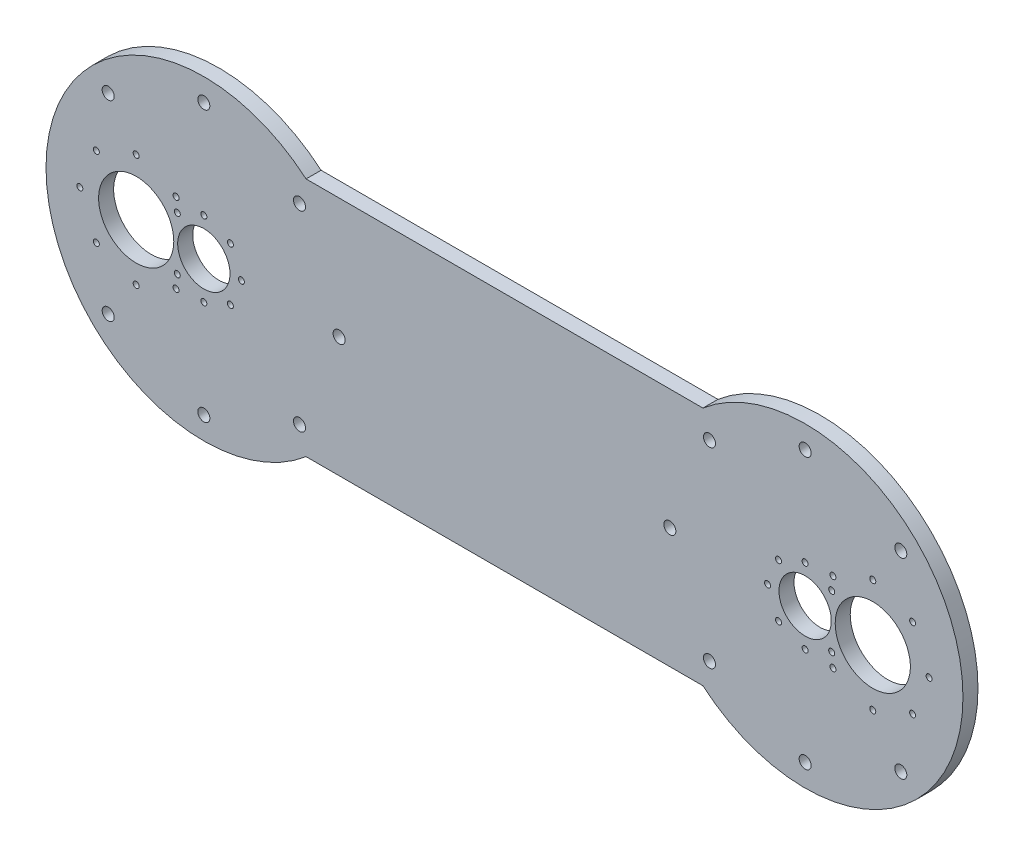
from build123d import *

# Parameters (mm, degrees)
SKETCH1_R           = 3.175
SKETCH1_R_2         = 2.54
BOSS_EXTRUDE1_DEPTH = 3.175
SKETCH2_R           = 11.049
SKETCH2_R_2         = 15.875
SKETCH2_R_3         = 1.27
CUT_EXTRUDE1_DEPTH  = 205.928972451


with BuildPart() as part:
    # Sketch1 → Boss-Extrude1 (new, symmetric)
    with BuildSketch(Plane.XY):
        with BuildLine():
            Line((-83.815331135, 50.8), (83.815331135, 50.8))
            ThreePointArc((83.815331135, 50.8), (193.675, 0), (83.815331135, -50.8))
            Line((83.815331135, -50.8), (-83.815331135, -50.8))
            ThreePointArc((-83.815331135, -50.8), (-193.675, 0), (-83.815331135, 50.8))
        make_face()
        with Locations((-127, 0)):
            Circle(SKETCH1_R, mode=Mode.SUBTRACT)
        with Locations((127, 0)):
            Circle(SKETCH1_R, mode=Mode.SUBTRACT)
        with Locations((-127, 57.15)):
            Circle(SKETCH1_R_2, mode=Mode.SUBTRACT)
        with Locations((-86.588847455, 40.411152545)):
            Circle(SKETCH1_R_2, mode=Mode.SUBTRACT)
        with Locations((-69.85, 0)):
            Circle(SKETCH1_R_2, mode=Mode.SUBTRACT)
        with Locations((-86.588847455, -40.411152545)):
            Circle(SKETCH1_R_2, mode=Mode.SUBTRACT)
        with Locations((-127, -57.15)):
            Circle(SKETCH1_R_2, mode=Mode.SUBTRACT)
        with Locations((-167.411152545, -40.411152545)):
            Circle(SKETCH1_R_2, mode=Mode.SUBTRACT)
        with Locations((-167.411152545, 40.411152545)):
            Circle(SKETCH1_R_2, mode=Mode.SUBTRACT)
        with Locations(Location((127, 57.15, 0), (0, 0, 180))):
            Circle(SKETCH1_R_2, mode=Mode.SUBTRACT)
        with Locations(Location((167.411152545, 40.411152545, 0), (0, 0, 180))):
            Circle(SKETCH1_R_2, mode=Mode.SUBTRACT)
        with Locations(Location((167.411152545, -40.411152545, 0), (0, 0, 180))):
            Circle(SKETCH1_R_2, mode=Mode.SUBTRACT)
        with Locations(Location((127, -57.15, 0), (0, 0, 180))):
            Circle(SKETCH1_R_2, mode=Mode.SUBTRACT)
        with Locations(Location((86.588847455, -40.411152545, 0), (0, 0, 180))):
            Circle(SKETCH1_R_2, mode=Mode.SUBTRACT)
        with Locations(Location((69.85, 0, 0), (0, 0, 180))):
            Circle(SKETCH1_R_2, mode=Mode.SUBTRACT)
        with Locations(Location((86.588847455, 40.411152545, 0), (0, 0, 180))):
            Circle(SKETCH1_R_2, mode=Mode.SUBTRACT)
    extrude(amount=BOSS_EXTRUDE1_DEPTH, both=True)

    # Sketch2 → Cut-Extrude1 (cut, through all)
    with BuildSketch(Plane.XY.offset(3.175)):
        with Locations((-127, 0)):
            Circle(SKETCH2_R)
        with Locations((-155.575, 0)):
            Circle(SKETCH2_R_2)
        with Locations((-155.575, 23.8125)):
            Circle(SKETCH2_R_3)
        with Locations((-138.737019773, 16.837980227)):
            Circle(SKETCH2_R_3)
        with Locations((-138.737019773, -16.837980227)):
            Circle(SKETCH2_R_3)
        with Locations((-155.575, -23.8125)):
            Circle(SKETCH2_R_3)
        with Locations((-172.412980227, -16.837980227)):
            Circle(SKETCH2_R_3)
        with Locations((-179.3875, 0)):
            Circle(SKETCH2_R_3)
        with Locations((-172.412980227, 16.837980227)):
            Circle(SKETCH2_R_3)
        with Locations((-127, 15.875)):
            Circle(SKETCH2_R_3)
        with Locations((-115.774679849, 11.225320151)):
            Circle(SKETCH2_R_3)
        with Locations((-111.125, 0)):
            Circle(SKETCH2_R_3)
        with Locations((-115.774679849, -11.225320151)):
            Circle(SKETCH2_R_3)
        with Locations((-127, -15.875)):
            Circle(SKETCH2_R_3)
        with Locations((-138.225320151, -11.225320151)):
            Circle(SKETCH2_R_3)
        with Locations(Location((138.225320151, 11.225320151, 0), (0, 0, 180))):
            Circle(SKETCH2_R_3)
        with Locations((-138.225320151, 11.225320151)):
            Circle(SKETCH2_R_3)
        with Locations(Location((138.225320151, -11.225320151, 0), (0, 0, 180))):
            Circle(SKETCH2_R_3)
        with Locations(Location((127, -15.875, 0), (0, 0, 180))):
            Circle(SKETCH2_R_3)
        with Locations(Location((115.774679849, -11.225320151, 0), (0, 0, 180))):
            Circle(SKETCH2_R_3)
        with Locations(Location((111.125, 0, 0), (0, 0, 180))):
            Circle(SKETCH2_R_3)
        with Locations(Location((115.774679849, 11.225320151, 0), (0, 0, 180))):
            Circle(SKETCH2_R_3)
        with Locations(Location((127, 15.875, 0), (0, 0, 180))):
            Circle(SKETCH2_R_3)
        with Locations(Location((172.412980227, 16.837980227, 0), (0, 0, 180))):
            Circle(SKETCH2_R_3)
        with Locations(Location((179.3875, 0, 0), (0, 0, 180))):
            Circle(SKETCH2_R_3)
        with Locations(Location((172.412980227, -16.837980227, 0), (0, 0, 180))):
            Circle(SKETCH2_R_3)
        with Locations(Location((155.575, -23.8125, 0), (0, 0, 180))):
            Circle(SKETCH2_R_3)
        with Locations(Location((138.737019773, -16.837980227, 0), (0, 0, 180))):
            Circle(SKETCH2_R_3)
        with Locations(Location((138.737019773, 16.837980227, 0), (0, 0, 180))):
            Circle(SKETCH2_R_3)
        with Locations(Location((155.575, 23.8125, 0), (0, 0, 180))):
            Circle(SKETCH2_R_3)
        with Locations(Location((155.575, 0, 0), (0, 0, 180))):
            Circle(SKETCH2_R_2)
        with Locations(Location((127, 0, 0), (0, 0, 180))):
            Circle(SKETCH2_R)
    extrude(amount=-CUT_EXTRUDE1_DEPTH, mode=Mode.SUBTRACT)


solid = part.part
